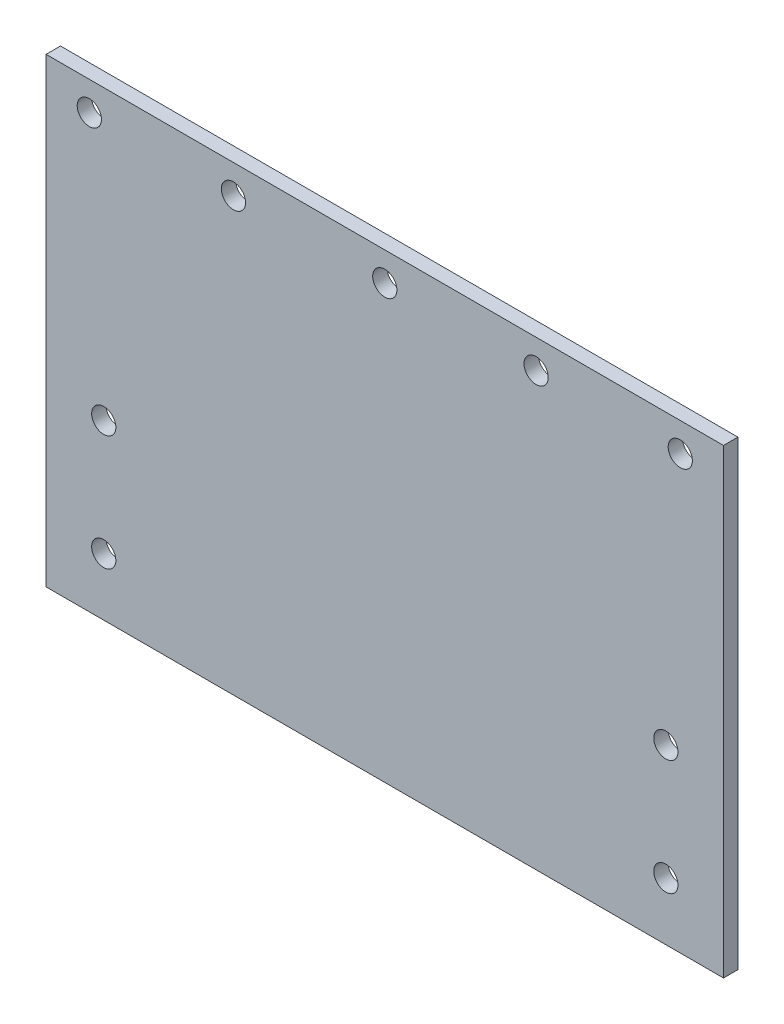
from build123d import *

# Parameters (mm, degrees)
SKETCH1_W            = 235
SKETCH1_H            = 160
BOSS_EXTRUDE1_DEPTH  = 5
M8_CLEARANCE_HOLE1_D = 8.4


with BuildPart() as part:
    # Sketch1 → Boss-Extrude1 (new body)
    with BuildSketch(Plane.XY):
        Rectangle(SKETCH1_W, SKETCH1_H)
    extrude(amount=BOSS_EXTRUDE1_DEPTH)

    # M8 Clearance Hole1 (through all)
    with Locations(Plane.XY.offset(5)):
        with Locations((-102.5, 70), (-97.5, -20), (-97.5, -60), (-52.5, 70), (0, 70), (52.5, 70), (102.5, 70), (97.5, -20), (97.5, -60)):
            Hole(M8_CLEARANCE_HOLE1_D / 2)


solid = part.part
